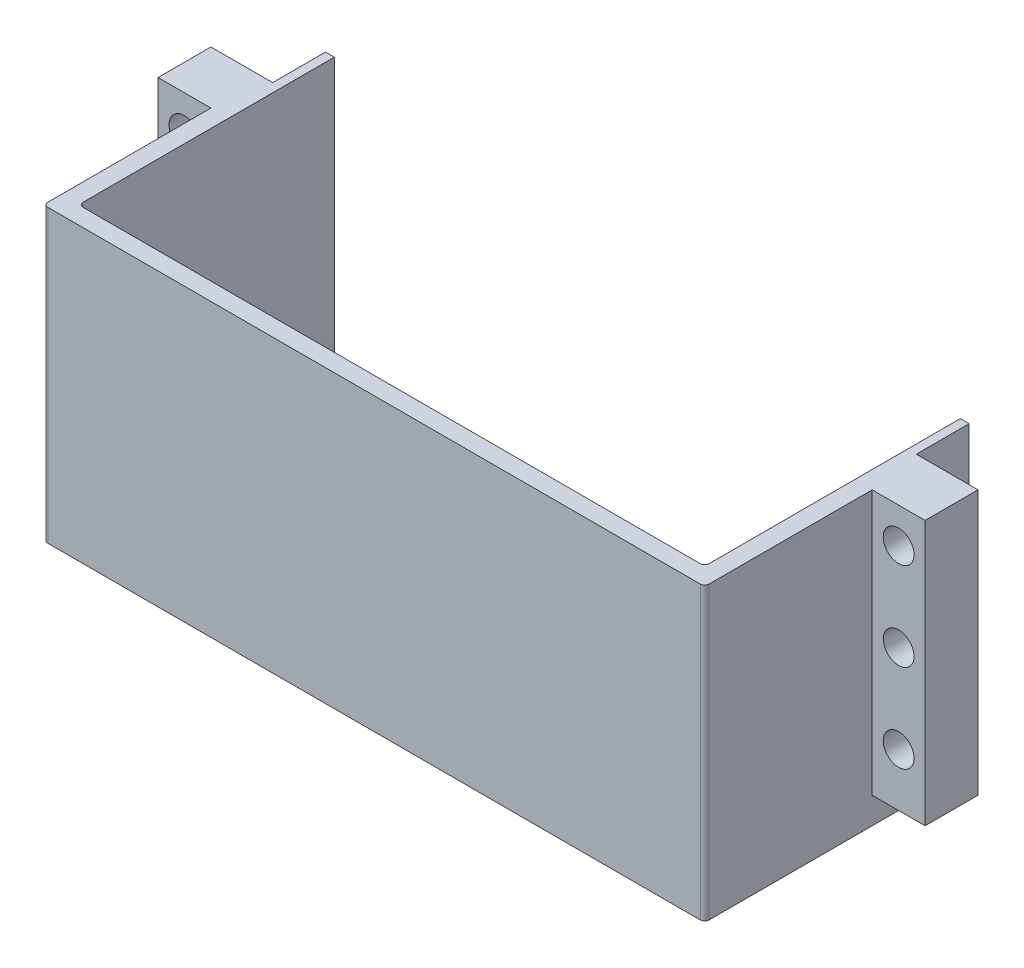
from build123d import *

# Parameters (mm, degrees)
SKETCH2_W           = 75
SKETCH2_H           = 25
BOSS_EXTRUDE1_DEPTH = 3
BOSS_EXTRUDE2_DEPTH = 30
SKETCH4_W           = 6
SKETCH4_H           = 30
BOSS_EXTRUDE3_DEPTH = 6
SKETCH5_W           = 6
SKETCH5_H           = 30
BOSS_EXTRUDE4_DEPTH = 6
SKETCH6_R           = 1.75
CUT_EXTRUDE1_DEPTH  = 16
BOSS_EXTRUDE5_DEPTH = 6
FILLET1_R           = 0.5
FILLET2_R           = 0.5


with BuildPart() as part:
    # Sketch2 → Boss-Extrude1 (new body)
    with BuildSketch(Plane(origin=(0, 0, 0), x_dir=(1, 0, 0), z_dir=(0, 1, 0))):
        with Locations((0, 12.5)):
            Rectangle(SKETCH2_W, SKETCH2_H)
    extrude(amount=BOSS_EXTRUDE1_DEPTH)

    # Sketch3 → Boss-Extrude2 (add)
    with BuildSketch(Plane(origin=(0, 3, 0), x_dir=(1, 0, 0), z_dir=(0, 1, 0))):
        Polygon((-35.5, 25), (-35.5, 2), (35.5, 2), (35.5, 25), (37.5, 25), (37.5, 0), (-37.5, 0), (-37.5, 25), align=None)
    extrude(amount=BOSS_EXTRUDE2_DEPTH)

    # Sketch4 → Boss-Extrude3 (add)
    with BuildSketch(Plane(origin=(37.5, 0, 0), x_dir=(0, 0, -1), z_dir=(1, 0, 0))):
        with Locations((22, 18)):
            Rectangle(SKETCH4_W, SKETCH4_H)
    extrude(amount=BOSS_EXTRUDE3_DEPTH)

    # Sketch5 → Boss-Extrude4 (add)
    with BuildSketch(Plane.ZY.offset(37.5)):
        with Locations((-22, 18)):
            Rectangle(SKETCH5_W, SKETCH5_H)
    extrude(amount=BOSS_EXTRUDE4_DEPTH)

    # Sketch6 → Cut-Extrude1 (cut)
    with BuildSketch(Plane(origin=(0, 0, -25), x_dir=(-1, 0, 0), z_dir=(0, 0, -1))):
        with Locations((-40.5, 29)):
            Circle(SKETCH6_R)
        with Locations((40.5, 29)):
            Circle(SKETCH6_R)
        with Locations((-40.5, 19)):
            Circle(SKETCH6_R)
        with Locations((-40.5, 9)):
            Circle(SKETCH6_R)
        with Locations((40.5, 19)):
            Circle(SKETCH6_R)
        with Locations((40.5, 9)):
            Circle(SKETCH6_R)
    extrude(amount=-CUT_EXTRUDE1_DEPTH, mode=Mode.SUBTRACT)

    # Sketch7 → Boss-Extrude5 (add)
    with BuildSketch(Plane(origin=(0, 0, -25), x_dir=(-1, 0, 0), z_dir=(0, 0, -1))):
        Polygon((35.5, 33), (36.5, 33), (36.5, 2), (-36.5, 2), (-36.5, 33), (-35.5, 33), (-35.5, 3), (35.5, 3), align=None)
    extrude(amount=BOSS_EXTRUDE5_DEPTH)

    # Fillet1
    fillet1_edges = [part.edges().sort_by_distance(p)[0] for p in [
        (35.5, 18, -2),
        (-35.5, 18, -2),
    ]]
    fillet(fillet1_edges, radius=FILLET1_R)

    # Fillet2
    fillet2_edges = [part.edges().sort_by_distance(p)[0] for p in [
        (37.5, 16.5, 0),
        (-37.5, 16.5, 0),
    ]]
    fillet(fillet2_edges, radius=FILLET2_R)


solid = part.part
